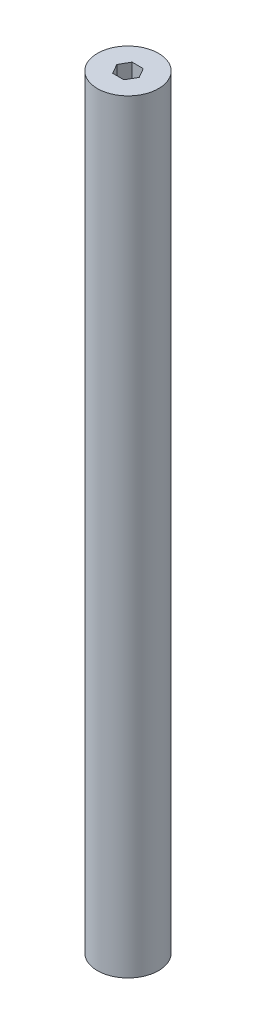
from build123d import *

# Parameters (mm, degrees)
SKETCH1_R           = 60
BOSS_EXTRUDE1_DEPTH = 1500
CUT_EXTRUDE1_REACH  = 1504.398


with BuildPart() as part:
    # Sketch1 → Boss-Extrude1 (new body)
    with BuildSketch(Plane(origin=(0, 0, 0), x_dir=(1, 0, 0), z_dir=(0, 1, 0))):
        with Locations(Location((0, 0, 0), (0, 0, 270))):
            Circle(SKETCH1_R)
    extrude(amount=BOSS_EXTRUDE1_DEPTH)

    # Sketch2 → Cut-Extrude1 (cut, up to next)
    with BuildSketch(Plane(origin=(0, 1500, 0), x_dir=(1, 0, 0), z_dir=(0, 1, 0)), mode=Mode.PRIVATE) as cut_extrude1_sk1:
        Polygon((-10.998522628, 19.05), (-21.997045256, 0), (-10.998522628, -19.05), (10.998522628, -19.05), (21.997045256, 0), (10.998522628, 19.05), align=None)
    cut_extrude1_tool1 = extrude(cut_extrude1_sk1.sketch, amount=-CUT_EXTRUDE1_REACH, mode=Mode.PRIVATE) & part.part
    add(cut_extrude1_tool1.solids().sort_by_distance((0, 1500, 0))[0], mode=Mode.SUBTRACT)


solid = part.part
